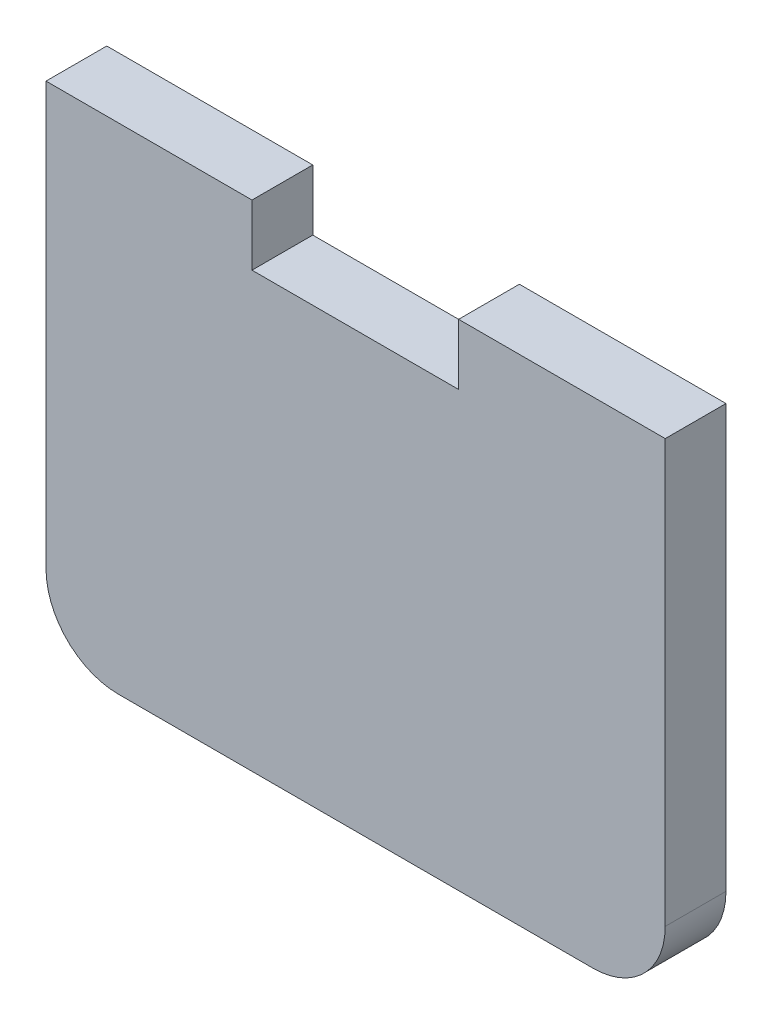
from build123d import *

# Parameters (mm, degrees)
SKETCH1_W           = 54.356
SKETCH1_H           = 43.434
BOSS_EXTRUDE1_DEPTH = 5.334
SKETCH2_W           = 18.137033298
SKETCH2_H           = 5.334
CUT_EXTRUDE1_DEPTH  = 41.016719041
FILLET1_R           = 6.35


with BuildPart() as part:
    # Sketch1 → Boss-Extrude1 (new body)
    with BuildSketch(Plane.XY):
        with Locations((-3.35450847, 3.594107707)):
            Rectangle(SKETCH1_W, SKETCH1_H)
    extrude(amount=BOSS_EXTRUDE1_DEPTH)

    # Sketch2 → Cut-Extrude1 (cut, through all)
    with BuildSketch(Plane.XY.offset(5.334)):
        with Locations((-3.382058417, 22.644107707)):
            Rectangle(SKETCH2_W, SKETCH2_H)
    extrude(amount=-CUT_EXTRUDE1_DEPTH, mode=Mode.SUBTRACT)

    # Fillet1
    fillet1_edges = [part.edges().sort_by_distance(p)[0] for p in [
        (23.82349153, -18.122892293, 2.667),
        (-30.53250847, -18.122892293, 2.667),
    ]]
    fillet(fillet1_edges, radius=FILLET1_R)


solid = part.part
